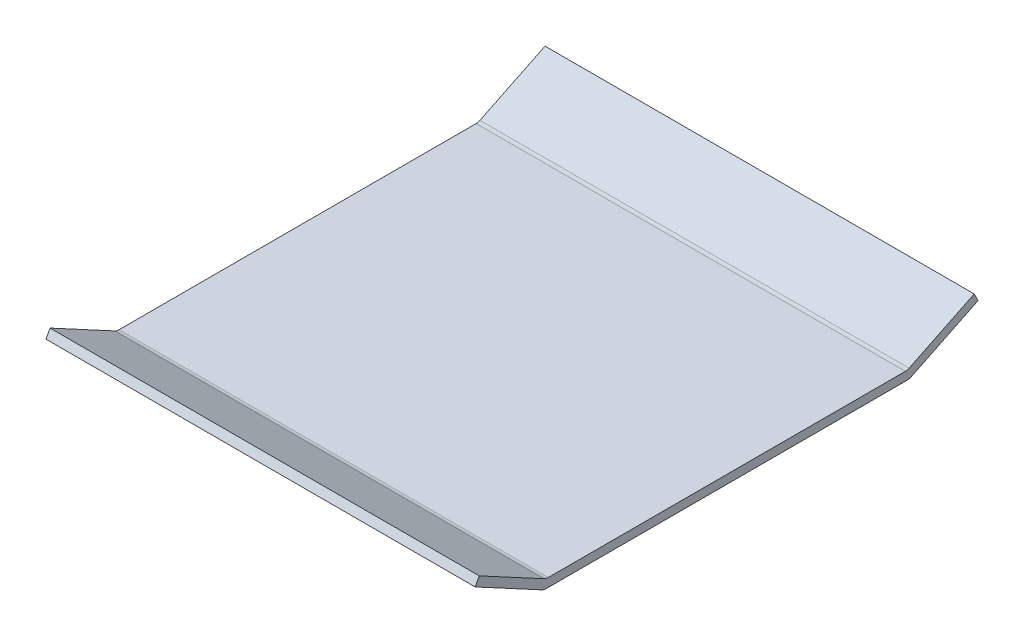
from build123d import *

# Parameters (mm, degrees)
BOSS_EXTRUDE1_START = 50.8
BOSS_EXTRUDE1_DEPTH = 158.75


with BuildPart() as part:
    # Sketch2 → Boss-Extrude1 (new body)
    with BuildSketch(Plane(origin=(0, 0, 0), x_dir=(0, 0, -1), z_dir=(1, 0, 0)).offset(BOSS_EXTRUDE1_START)):
        with BuildLine():
            Line((223.286729101, 31.503116997), (247.278106278, 18.598154513))
            ThreePointArc((247.278106278, 18.598154513), (248.00664125, 18.315474111), (248.782155913, 18.219305384))
            Line((248.782155913, 18.219305384), (380.892090883, 18.219305384))
            ThreePointArc((380.892090883, 18.219305384), (381.606009815, 18.300611029), (382.283364565, 18.540363804))
            Line((382.283364565, 18.540363804), (406.366180194, 30.280543711))
            Line((406.366180194, 30.280543711), (407.757453877, 27.426602131))
            Line((407.757453877, 27.426602131), (383.016046062, 15.365363804))
            ThreePointArc((383.016046062, 15.365363804), (382.338691312, 15.125611029), (381.62477238, 15.044305384))
            Line((381.62477238, 15.044305384), (247.982417689, 15.044305384))
            ThreePointArc((247.982417689, 15.044305384), (247.206903026, 15.140474111), (246.478368054, 15.423154513))
            Line((246.478368054, 15.423154513), (221.782679465, 28.706966126))
            Line((221.782679465, 28.706966126), (223.286729101, 31.503116997))
        make_face()
    extrude(amount=-BOSS_EXTRUDE1_DEPTH)


solid = part.part
